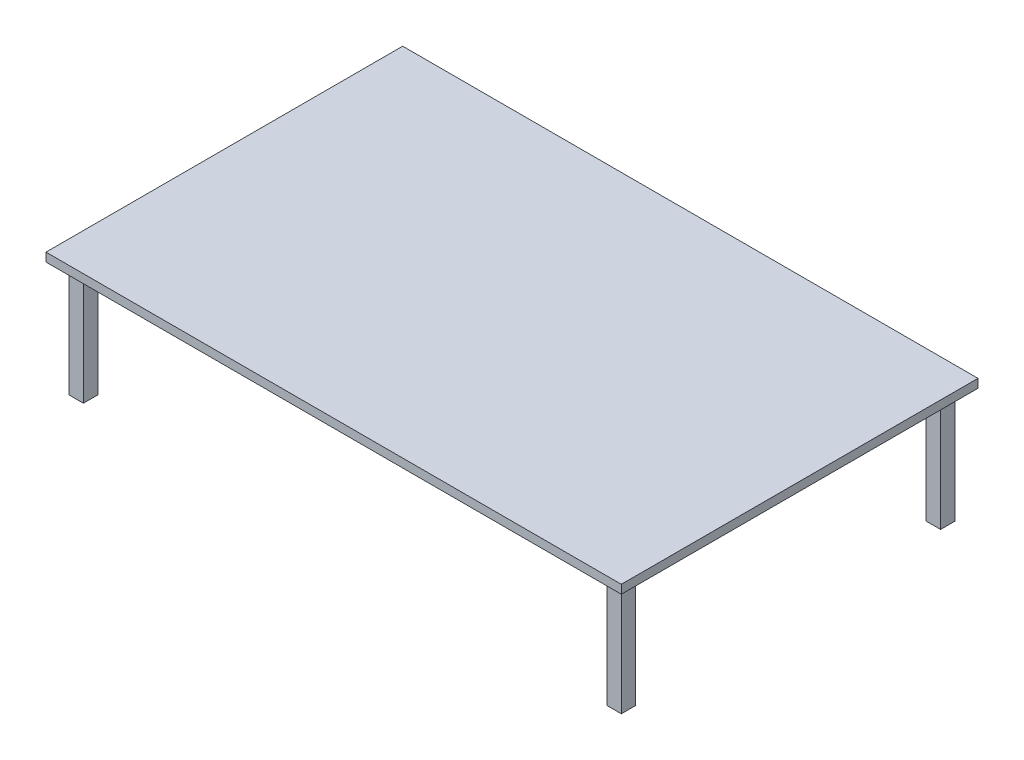
from build123d import *

# Parameters (mm, degrees)
SKETCH1_W             = 25
SKETCH1_H             = 25
BOSS_EXTRUDE1_DEPTH   = 200
BOSS_EXTRUDE1_2_DEPTH = 200
BOSS_EXTRUDE1_3_DEPTH = 200
BOSS_EXTRUDE1_4_DEPTH = 200
SKETCH2_W             = 1000
SKETCH2_H             = 620
BOSS_EXTRUDE2_DEPTH   = 15


with BuildPart() as part:
    # Sketch1 → Boss-Extrude1 (new body)
    with BuildSketch(Plane(origin=(0, 0, 0), x_dir=(1, 0, 0), z_dir=(0, 1, 0))):
        with Locations((-467.5, -277.5)):
            Rectangle(SKETCH1_W, SKETCH1_H)
    extrude(amount=BOSS_EXTRUDE1_DEPTH)



with BuildPart() as body_2:
    # Sketch1 → Boss-Extrude1 2 (new body)
    with BuildSketch(Plane(origin=(0, 0, 0), x_dir=(1, 0, 0), z_dir=(0, 1, 0))):
        with Locations((-467.5, 277.5)):
            Rectangle(SKETCH1_W, SKETCH1_H)
    extrude(amount=BOSS_EXTRUDE1_2_DEPTH)


with BuildPart() as body_3:
    # Sketch1 → Boss-Extrude1 3 (new body)
    with BuildSketch(Plane(origin=(0, 0, 0), x_dir=(1, 0, 0), z_dir=(0, 1, 0))):
        with Locations((467.5, 277.5)):
            Rectangle(SKETCH1_W, SKETCH1_H)
    extrude(amount=BOSS_EXTRUDE1_3_DEPTH)


with BuildPart() as body_4:
    # Sketch1 → Boss-Extrude1 4 (new body)
    with BuildSketch(Plane(origin=(0, 0, 0), x_dir=(1, 0, 0), z_dir=(0, 1, 0))):
        with Locations((467.5, -277.5)):
            Rectangle(SKETCH1_W, SKETCH1_H)
    extrude(amount=BOSS_EXTRUDE1_4_DEPTH)


with BuildPart() as part_1:
    add(part.part)

    add(body_2.part)  # Boss-Extrude2 merges body 2

    add(body_3.part)  # Boss-Extrude2 merges body 3

    add(body_4.part)  # Boss-Extrude2 merges body 4
    # Sketch2 → Boss-Extrude2 (add)
    with BuildSketch(Plane(origin=(0, 200, 0), x_dir=(1, 0, 0), z_dir=(0, 1, 0))):
        Rectangle(SKETCH2_W, SKETCH2_H)
    extrude(amount=BOSS_EXTRUDE2_DEPTH)


solid = part_1.part
